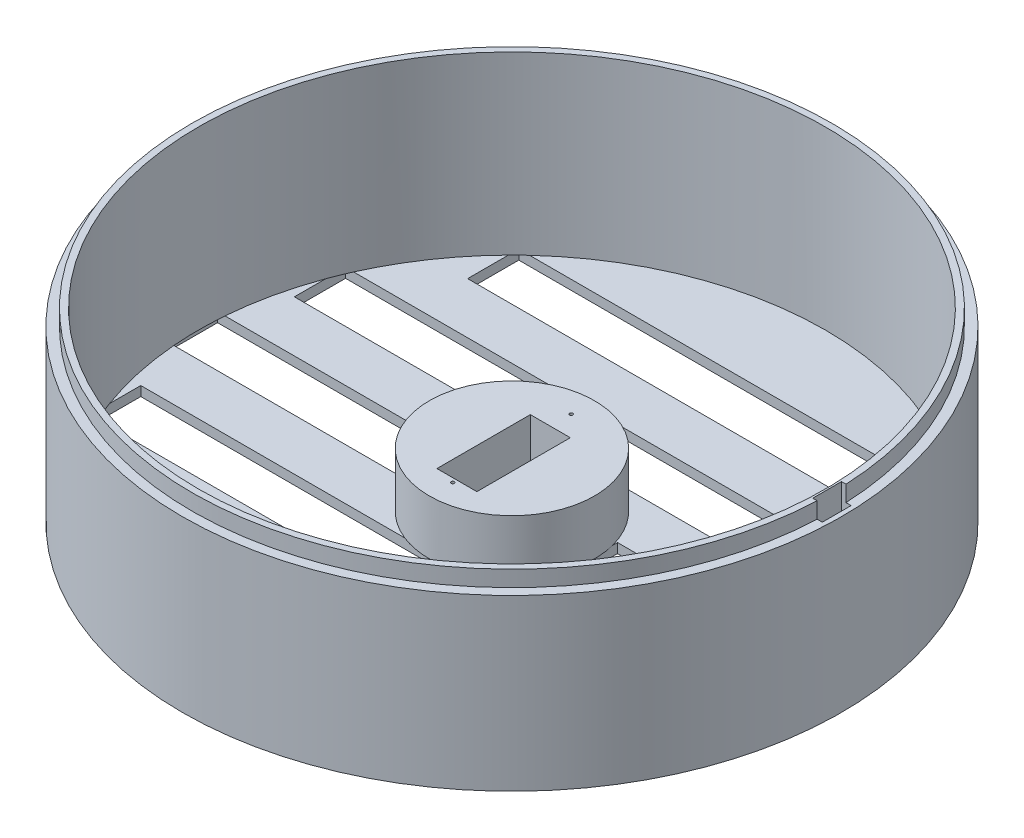
from build123d import *

# Parameters (mm, degrees)
SKETCH_1_R          = 103
EXTRUDE_1_DEPTH     = 3
SKETCH_2_W          = 30
SKETCH_2_H          = 42
SKETCH_2_W_2        = 24
SKETCH_2_H_2        = 32
EXTRUDE_2_DEPTH     = 25
SKETCH_3_R          = 0.5
CUT_EXTRUDE_1_DEPTH = 25
CUT_EXTRUDE_2_DEPTH = 25
SKETCH_5_R          = 103
SKETCH_5_R_2        = 100.319489632
EXTRUDE_3_DEPTH     = 50
SKETCH_6_W          = 139.713993572
SKETCH_6_H          = 16
SKETCH_6_W_2        = 184
SKETCH_6_W_3        = 75
CUT_EXTRUDE_3_DEPTH = 50
EXTRUDE_START       = -5
SKETCH_7_R          = 103
SKETCH_7_R_2        = 98
EXTRUDE_4_DEPTH     = 5
SKETCH_8_R          = 100
SKETCH_8_R_2        = 98
EXTRUDE_5_DEPTH     = 5
EXTRUDE_6_DEPTH     = 25
SKETCH_10_W         = 24
SKETCH_10_H         = 32
SKETCH_10_W_2       = 12.5
SKETCH_10_H_2       = 24
EXTRUDE_7_DEPTH     = 25
SKETCH_11_R         = 25.806975801
SKETCH_11_W         = 12.5
SKETCH_11_H         = 24
CUT_EXTRUDE_4_DEPTH = 8
SKETCH_12_W         = 12.5
SKETCH_12_H         = 24
CUT_EXTRUDE_5_DEPTH = 8
SKETCH_13_W         = 12.5
SKETCH_13_H         = 5.2
CUT_EXTRUDE_6_DEPTH = 100
SKETCH_14_R         = 103
SKETCH_14_R_2       = 98
EXTRUDE_9_DEPTH     = 50
SKETCH_15_W         = 3
SKETCH_15_H         = 9
CUT_EXTRUDE_7_DEPTH = 70


with BuildPart() as part:
    # 草图1 → 凸台-拉伸1 (new body)
    with BuildSketch(Plane(origin=(0, 0, 0), x_dir=(1, 0, 0), z_dir=(0, 1, 0))):
        with Locations(Location((0, 0, 0), (0, 0, 270))):
            Circle(SKETCH_1_R)
    extrude(amount=EXTRUDE_1_DEPTH)

    # 草图2 → 凸台-拉伸2 (add)
    with BuildSketch(Plane(origin=(0, 3, 0), x_dir=(1, 0, 0), z_dir=(0, 1, 0))):
        Rectangle(SKETCH_2_W, SKETCH_2_H)
        Rectangle(SKETCH_2_W_2, SKETCH_2_H_2, mode=Mode.SUBTRACT)
    extrude(amount=EXTRUDE_2_DEPTH)

    # 草图3 → 切除-拉伸1 (cut)
    with BuildSketch(Plane(origin=(0, 28, 0), x_dir=(1, 0, 0), z_dir=(0, 1, 0))):
        with Locations(Location((0, -18.5, 0), (0, 0, 270))):
            Circle(SKETCH_3_R)
        with Locations(Location((0, 18.5, 0), (0, 0, 270))):
            Circle(SKETCH_3_R)
    extrude(amount=-CUT_EXTRUDE_1_DEPTH, mode=Mode.SUBTRACT)

    # 草图4 → 切除-拉伸2 (cut)
    with BuildSketch(Plane(origin=(0, 3, 0), x_dir=(1, 0, 0), z_dir=(0, 1, 0))):
        Polygon((25, 0), (25, -8), (100, -8), (100, 0), (100, 8), (25, 8), align=None)
    extrude(amount=-CUT_EXTRUDE_2_DEPTH, mode=Mode.SUBTRACT)

    # 草图5 → 凸台-拉伸3 (add)
    with BuildSketch(Plane(origin=(0, 3, 0), x_dir=(1, 0, 0), z_dir=(0, 1, 0))):
        with Locations(Location((0, 0, 0), (0, 0, 270))):
            Circle(SKETCH_5_R)
        with Locations(Location((0, 0, 0), (0, 0, 4.57392126))):
            Circle(SKETCH_5_R_2, mode=Mode.SUBTRACT)
    extrude(amount=EXTRUDE_3_DEPTH)

    # 草图6 → 切除-拉伸3 (cut)
    with BuildSketch(Plane(origin=(0, 3, 0), x_dir=(1, 0, 0), z_dir=(0, 1, 0))):
        with Locations((0, -64)):
            Rectangle(SKETCH_6_W, SKETCH_6_H)
        with Locations((0, -32)):
            Rectangle(SKETCH_6_W_2, SKETCH_6_H)
        with Locations((-62.5, 0)):
            Rectangle(SKETCH_6_W_3, SKETCH_6_H)
        with Locations((0, 32)):
            Rectangle(SKETCH_6_W_2, SKETCH_6_H)
        with Locations((0, 64)):
            Rectangle(SKETCH_6_W, SKETCH_6_H)
    extrude(amount=-CUT_EXTRUDE_3_DEPTH, mode=Mode.SUBTRACT)

    # 草图7 → 凸台-拉伸4 (add)
    with BuildSketch(Plane(origin=(0, 53, 0), x_dir=(1, 0, 0), z_dir=(0, 1, 0)).offset(EXTRUDE_START)):
        with Locations(Location((0, 0, 0), (0, 0, 270))):
            Circle(SKETCH_7_R)
        with Locations(Location((0, 0, 0), (0, 0, 270))):
            Circle(SKETCH_7_R_2, mode=Mode.SUBTRACT)
    extrude(amount=EXTRUDE_4_DEPTH)

    # 草图8 → 凸台-拉伸5 (add)
    with BuildSketch(Plane(origin=(0, 53, 0), x_dir=(1, 0, 0), z_dir=(0, 1, 0))):
        with Locations(Location((0, 0, 0), (0, 0, 270))):
            Circle(SKETCH_8_R)
        with Locations(Location((0, 0, 0), (0, 0, 270))):
            Circle(SKETCH_8_R_2, mode=Mode.SUBTRACT)
    extrude(amount=EXTRUDE_5_DEPTH)

    # 草图9 → 凸台-拉伸6 (add)
    with BuildSketch(Plane(origin=(0, 28, 0), x_dir=(1, 0, 0), z_dir=(0, 1, 0))):
        with BuildLine():
            ThreePointArc((25.806975801, 0), (22.946727839, 11.808796784), (15, 21))
            Line((15, 21), (15, -21))
            ThreePointArc((15, -21), (22.946727839, -11.808796784), (25.806975801, 0))
        make_face()
        with BuildLine():
            ThreePointArc((15, 21), (0, 25.806975801), (-15, 21))
            Line((-15, 21), (15, 21))
        make_face()
        with BuildLine():
            Line((-15, -21), (-15, 21))
            ThreePointArc((-15, 21), (-25.806975801, 0), (-15, -21))
        make_face()
        with BuildLine():
            Line((15, -21), (-15, -21))
            ThreePointArc((-15, -21), (0, -25.806975801), (15, -21))
        make_face()
    extrude(amount=-EXTRUDE_6_DEPTH)

    # 草图10 → 凸台-拉伸7 (add)
    with BuildSketch(Plane(origin=(0, 28, 0), x_dir=(1, 0, 0), z_dir=(0, 1, 0))):
        Rectangle(SKETCH_10_W, SKETCH_10_H)
        Rectangle(SKETCH_10_W_2, SKETCH_10_H_2, mode=Mode.SUBTRACT)
    extrude(amount=-EXTRUDE_7_DEPTH)

    # 草图11 → 切除-拉伸4 (cut)
    with BuildSketch(Plane(origin=(0, 28, 0), x_dir=(1, 0, 0), z_dir=(0, 1, 0))):
        with Locations(Location((0, 0, 0), (0, 0, 270))):
            Circle(SKETCH_11_R)
        Rectangle(SKETCH_11_W, SKETCH_11_H, mode=Mode.SUBTRACT)
    extrude(amount=-CUT_EXTRUDE_4_DEPTH, mode=Mode.SUBTRACT)

    # 草图12 → 切除-拉伸5 (cut)
    with BuildSketch(Plane.XZ):
        Rectangle(SKETCH_12_W, SKETCH_12_H)
    extrude(amount=-CUT_EXTRUDE_5_DEPTH, mode=Mode.SUBTRACT)

    # 草图13 → 切除-拉伸6 (cut)
    with BuildSketch(Plane(origin=(0, 20, 0), x_dir=(1, 0, 0), z_dir=(0, 1, 0))):
        with Locations((0, -14.6)):
            Rectangle(SKETCH_13_W, SKETCH_13_H)
    extrude(amount=-CUT_EXTRUDE_6_DEPTH, mode=Mode.SUBTRACT)

    # 草图14 → 凸台-拉伸9 (add)
    with BuildSketch(Plane(origin=(0, 3, 0), x_dir=(1, 0, 0), z_dir=(0, 1, 0))):
        with Locations(Location((0, 0, 0), (0, 0, 270))):
            Circle(SKETCH_14_R)
        with Locations(Location((0, 0, 0), (0, 0, 270))):
            Circle(SKETCH_14_R_2, mode=Mode.SUBTRACT)
    extrude(amount=EXTRUDE_9_DEPTH)

    # 草图15 → 切除-拉伸7 (cut)
    with BuildSketch(Plane(origin=(0, 58, 0), x_dir=(1, 0, 0), z_dir=(0, 1, 0))):
        with Locations((100, 0)):
            Rectangle(SKETCH_15_W, SKETCH_15_H)
    extrude(amount=-CUT_EXTRUDE_7_DEPTH, mode=Mode.SUBTRACT)


solid = part.part
